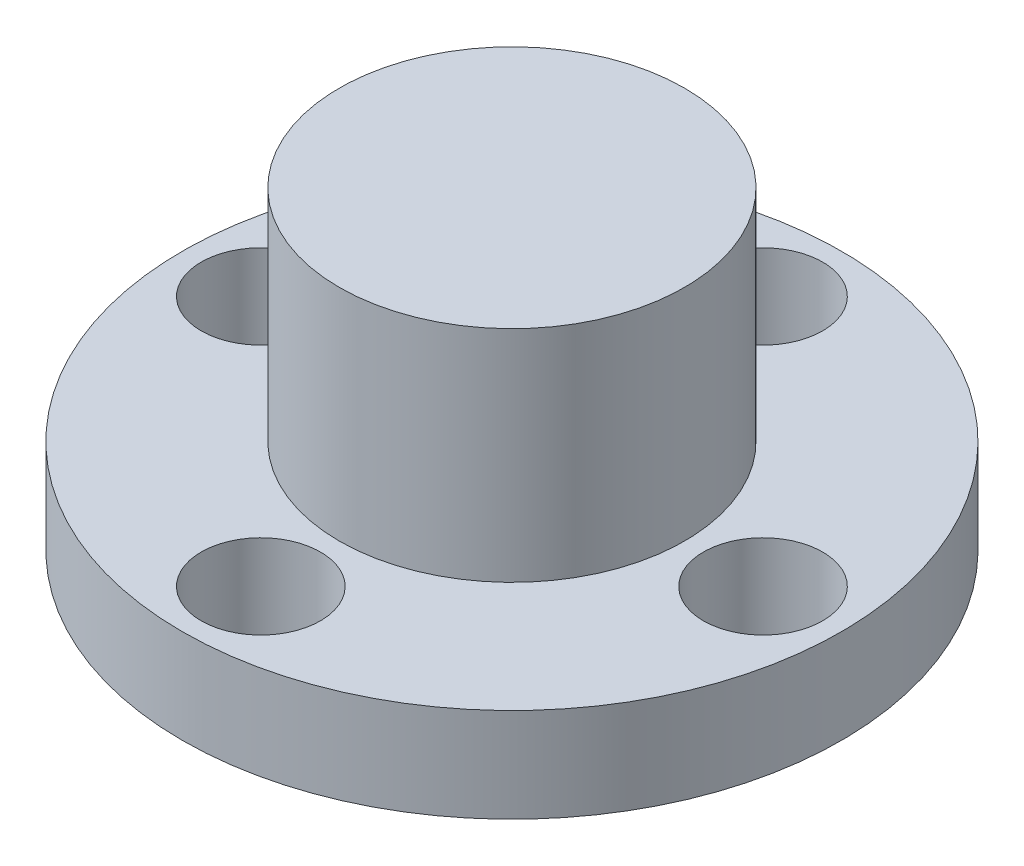
from build123d import *

# Parameters (mm, degrees)
SKETCH_1_R      = 10.5
SKETCH_1_R_2    = 1.9
EXTRUDE_1_DEPTH = 3
SKETCH_1_3_R    = 5.5
EXTRUDE_2_DEPTH = 10


with BuildPart() as part:
    # 草图1 → 凸台-拉伸1 (new body)
    with BuildSketch(Plane(origin=(0, 0, 0), x_dir=(1, 0, 0), z_dir=(0, 1, 0))):
        Circle(SKETCH_1_R)
        with Locations((0, -8)):
            Circle(SKETCH_1_R_2, mode=Mode.SUBTRACT)
        with Locations((-8, 0)):
            Circle(SKETCH_1_R_2, mode=Mode.SUBTRACT)
        with Locations((8, 0)):
            Circle(SKETCH_1_R_2, mode=Mode.SUBTRACT)
        with Locations((0, 8)):
            Circle(SKETCH_1_R_2, mode=Mode.SUBTRACT)
    extrude(amount=EXTRUDE_1_DEPTH)

    # 草图1<3> → 凸台-拉伸2 (add)
    with BuildSketch(Plane(origin=(0, 0, 0), x_dir=(1, 0, 0), z_dir=(0, 1, 0))):
        Circle(SKETCH_1_3_R)
    extrude(amount=EXTRUDE_2_DEPTH)


solid = part.part
